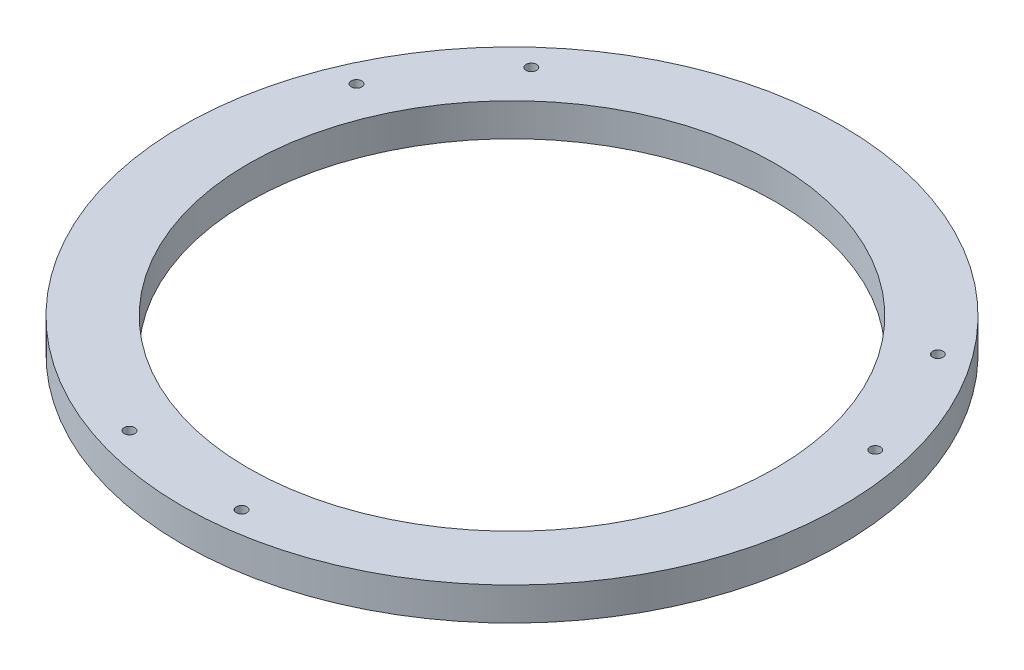
from build123d import *

# Parameters (mm, degrees)
SKETCH_1_R               = 100
SKETCH_1_R_2             = 80
EXTRUDE_1_DEPTH          = 10
SKETCH_3_R               = 1.6
CUT_EXTRUDE_2_DEPTH      = 142.774468788
CUT_EXTRUDE_3_DEPTH      = 3
PATTERN_CIRCULAR_1_COUNT = 3


with BuildPart() as part:
    # 草图1 → 凸台-拉伸1 (new body)
    with BuildSketch(Plane(origin=(0, 0, 0), x_dir=(1, 0, 0), z_dir=(0, 1, 0))):
        with Locations(Location((0, 0, 0), (0, 0, 270))):
            Circle(SKETCH_1_R)
        with Locations(Location((0, 0, 0), (0, 0, 270))):
            Circle(SKETCH_1_R_2, mode=Mode.SUBTRACT)
    extrude(amount=EXTRUDE_1_DEPTH)

    # 草图3 → 切除-拉伸2 (cut, through all)
    with BuildSketch(Plane(origin=(0, 10, 0), x_dir=(1, 0, 0), z_dir=(0, 1, 0))):
        with Locations(Location((-62.39260708, 68.252564653, 0), (0, 0, 270))):
            Circle(SKETCH_3_R)
        with Locations(Location((-84.573353466, 37.397832605, 0), (0, 0, 270))):
            Circle(SKETCH_3_R)
    cut_extrude_2 = extrude(amount=-CUT_EXTRUDE_2_DEPTH, mode=Mode.SUBTRACT)

    # 草图4 → 切除-拉伸3 (cut)
    with BuildSketch(Plane.XZ):
        Polygon((-80.877120495, -38.81834724), (-83.152838831, -33.701599634), (-88.269586436, -35.97731797), (-85.993868101, -41.094065575), align=None)
        Polygon((-62.126188983, -72.20339006), (-66.343432487, -68.51898275), (-62.659025177, -64.301739246), (-58.441781673, -67.986146556), align=None)
    cut_extrude_3 = extrude(amount=-CUT_EXTRUDE_3_DEPTH, mode=Mode.SUBTRACT)

    # 阵列(圆周)1: 切除-拉伸2, 切除-拉伸3 ×3 about axis
    pattern_circular_1_axis = Axis((0, 0, 0), (0, 1, 0))
    add([cut_extrude_2.rotate(pattern_circular_1_axis, i * 360 / PATTERN_CIRCULAR_1_COUNT) for i in range(1, PATTERN_CIRCULAR_1_COUNT)], mode=Mode.SUBTRACT)
    add([cut_extrude_3.rotate(pattern_circular_1_axis, i * 360 / PATTERN_CIRCULAR_1_COUNT) for i in range(1, PATTERN_CIRCULAR_1_COUNT)], mode=Mode.SUBTRACT)


solid = part.part
